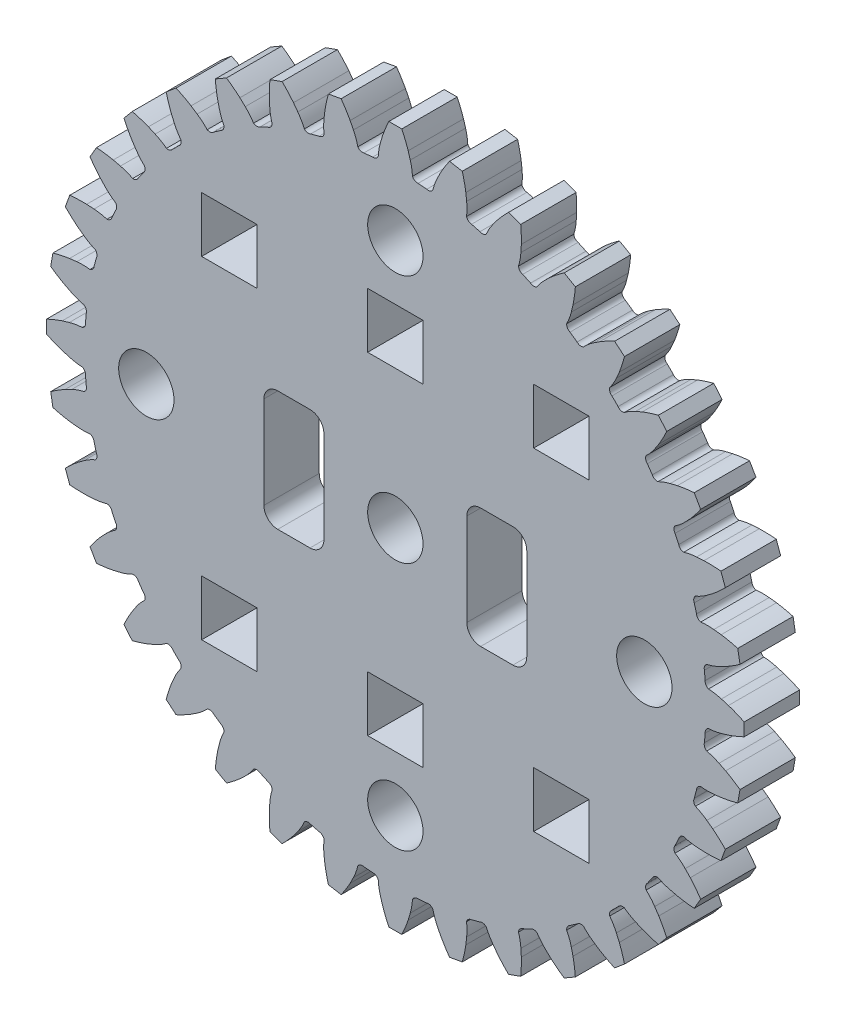
from build123d import *

# Parameters (mm, degrees)
MODEL_R                 = 1.5
MODEL_W                 = 3
MODEL_H                 = 3
SALIENTE_EXTRUIR1_DEPTH = 3


with BuildPart() as part:
    # Model → Saliente-Extruir1 (new body)
    with BuildSketch(Plane.XY):
        with BuildLine():
            Line((31.003175283, 290.835738864), (31.240405981, 291.156201018))
            ThreePointArc((31.240405981, 291.156201018), (31.538382446, 291.506827512), (31.857600686, 291.838231535))
            Line((31.857600686, 291.838231535), (32.515213457, 291.598880061))
            ThreePointArc((32.515213457, 291.598880061), (32.546726416, 291.139820321), (32.549611265, 290.679689264))
            Line((32.549611265, 290.679689264), (32.525351421, 290.281712059))
            ThreePointArc((32.525351421, 290.281712059), (32.481384061, 289.927376903), (32.396011436, 289.580681005))
            ThreePointArc((32.396011436, 289.580681005), (32.465041706, 289.408773691), (32.621932953, 289.310272727))
            Line((32.621932953, 289.310272727), (33.049303766, 289.110986444))
            ThreePointArc((33.049303766, 289.110986444), (33.225607631, 289.054115975), (33.401668077, 289.111735612))
            ThreePointArc((33.401668077, 289.111735612), (33.612376078, 289.399986665), (33.85555088, 289.661429864))
            Line((33.85555088, 289.661429864), (34.14482518, 289.935828799))
            ThreePointArc((34.14482518, 289.935828799), (34.499160364, 290.229385419), (34.871076667, 290.500323004))
            Line((34.871076667, 290.500323004), (35.477135875, 290.150414558))
            ThreePointArc((35.477135875, 290.150414558), (35.428455194, 289.692856799), (35.351395296, 289.239215218))
            Line((35.351395296, 289.239215218), (35.258395997, 288.851496858))
            ThreePointArc((35.258395997, 288.851496858), (35.153566946, 288.510179702), (35.009288212, 288.183575694))
            ThreePointArc((35.009288212, 288.183575694), (35.047418366, 288.002293058), (35.184821568, 287.878044666))
            Line((35.184821568, 287.878044666), (35.571093959, 287.607573826))
            ThreePointArc((35.571093959, 287.607573826), (35.734843919, 287.520952503), (35.918235156, 287.547124192))
            ThreePointArc((35.918235156, 287.547124192), (36.175796299, 287.794407003), (36.460675865, 288.009651431))
            Line((36.460675865, 288.009651431), (36.793204313, 288.229649676))
            ThreePointArc((36.793204313, 288.229649676), (37.193131921, 288.457216851), (37.606445798, 288.659455698))
            Line((37.606445798, 288.659455698), (38.14253664, 288.20962207))
            ThreePointArc((38.14253664, 288.20962207), (38.015141457, 287.767468953), (37.860478239, 287.334100518))
            Line((37.860478239, 287.334100518), (37.701565221, 286.96842163))
            ThreePointArc((37.701565221, 286.96842163), (37.539059657, 286.650493222), (37.340258651, 286.353904802))
            ThreePointArc((37.340258651, 286.353904802), (37.346330122, 286.168755024), (37.460070355, 286.022534429))
            Line((37.460070355, 286.022534429), (37.793507632, 285.689097152))
            ThreePointArc((37.793507632, 285.689097152), (37.939728227, 285.57535692), (38.124878005, 285.569285448))
            ThreePointArc((38.124878005, 285.569285448), (38.421466425, 285.768086455), (38.739394832, 285.930592019))
            Line((38.739394832, 285.930592019), (39.105073721, 286.089505036))
            ThreePointArc((39.105073721, 286.089505036), (39.538442155, 286.244168255), (39.980595272, 286.371563438))
            Line((39.980595272, 286.371563438), (40.430428901, 285.835472595))
            ThreePointArc((40.430428901, 285.835472595), (40.228190054, 285.422158719), (40.000622878, 285.02223111))
            Line((40.000622878, 285.02223111), (39.780624634, 284.689702662))
            ThreePointArc((39.780624634, 284.689702662), (39.565380206, 284.404823096), (39.318097395, 284.147261953))
            ThreePointArc((39.318097395, 284.147261953), (39.291925706, 283.963870717), (39.378547028, 283.800120757))
            Line((39.378547028, 283.800120757), (39.649017868, 283.413848366))
            ThreePointArc((39.649017868, 283.413848366), (39.77326626, 283.276445163), (39.954548897, 283.23831501))
            ThreePointArc((39.954548897, 283.23831501), (40.281152905, 283.382593743), (40.622470061, 283.487422794))
            Line((40.622470061, 283.487422794), (41.010188421, 283.580422093))
            ThreePointArc((41.010188421, 283.580422093), (41.463830001, 283.657481991), (41.92138776, 283.706162672))
            Line((41.92138776, 283.706162672), (42.271296207, 283.100103464))
            ThreePointArc((42.271296207, 283.100103464), (42.000358621, 282.728187161), (41.706802002, 282.373851977))
            Line((41.706802002, 282.373851977), (41.432403066, 282.084577678))
            ThreePointArc((41.432403066, 282.084577678), (41.170959867, 281.841402875), (40.882708815, 281.630694874))
            ThreePointArc((40.882708815, 281.630694874), (40.825089178, 281.454634429), (40.881959646, 281.278330564))
            Line((40.881959646, 281.278330564), (41.08124593, 280.85095975))
            ThreePointArc((41.08124593, 280.85095975), (41.179746893, 280.694068504), (41.351654208, 280.625038233))
            ThreePointArc((41.351654208, 280.625038233), (41.698350106, 280.710410858), (42.052685261, 280.754378218))
            Line((42.052685261, 280.754378218), (42.450662467, 280.778638062))
            ThreePointArc((42.450662467, 280.778638062), (42.910793523, 280.775753213), (43.369853263, 280.744240254))
            Line((43.369853263, 280.744240254), (43.609204738, 280.086627483))
            ThreePointArc((43.609204738, 280.086627483), (43.277800714, 279.767409243), (42.927174221, 279.469432778))
            Line((42.927174221, 279.469432778), (42.606712067, 279.232202081))
            ThreePointArc((42.606712067, 279.232202081), (42.307013916, 279.038120785), (41.986552984, 278.880668182))
            ThreePointArc((41.986552984, 278.880668182), (41.899236144, 278.717288035), (41.924627777, 278.533787169))
            Line((41.924627777, 278.533787169), (42.046674291, 278.078303378))
            ThreePointArc((42.046674291, 278.078303378), (42.116434925, 277.90669115), (42.2737436, 277.808858212))
            ThreePointArc((42.2737436, 277.808858212), (42.629997209, 277.832730724), (42.986584069, 277.814500467))
            Line((42.986584069, 277.814500467), (43.382727784, 277.769283733))
            ThreePointArc((43.382727784, 277.769283733), (43.835367467, 277.686541792), (44.281980891, 277.575792698))
            Line((44.281980891, 277.575792698), (44.403502819, 276.886607596))
            ThreePointArc((44.403502819, 276.886607596), (44.021701902, 276.629786702), (43.624659142, 276.397222822))
            Line((43.624659142, 276.397222822), (43.26787085, 276.21924386))
            ThreePointArc((43.26787085, 276.21924386), (42.939023924, 276.080153133), (42.596090156, 275.980740046))
            ThreePointArc((42.596090156, 275.980740046), (42.48172919, 275.835004421), (42.474870477, 275.649882134))
            Line((42.474870477, 275.649882134), (42.515968899, 275.180125011))
            ThreePointArc((42.515968899, 275.180125011), (42.554869562, 274.999006151), (42.692799853, 274.875343151))
            ThreePointArc((42.692799853, 274.875343151), (43.047786588, 274.836990196), (43.395790441, 274.757116239))
            Line((43.395790441, 274.757116239), (43.77806404, 274.643796814))
            ThreePointArc((43.77806404, 274.643796814), (44.209459122, 274.483711853), (44.630056106, 274.29709168))
            Line((44.630056106, 274.29709168), (44.630056106, 273.597274786))
            ThreePointArc((44.630056106, 273.597274786), (44.209459122, 273.410654613), (43.77806404, 273.250569652))
            Line((43.77806404, 273.250569652), (43.395790441, 273.137250227))
            ThreePointArc((43.395790441, 273.137250227), (43.047786588, 273.05737627), (42.692799853, 273.019023315))
            ThreePointArc((42.692799853, 273.019023315), (42.554869562, 272.895360315), (42.515968899, 272.714241455))
            Line((42.515968899, 272.714241455), (42.474870477, 272.244484332))
            ThreePointArc((42.474870477, 272.244484332), (42.48172919, 272.059362045), (42.596090156, 271.91362642))
            ThreePointArc((42.596090156, 271.91362642), (42.939023924, 271.814213333), (43.26787085, 271.675122606))
            Line((43.26787085, 271.675122606), (43.624659142, 271.497143644))
            ThreePointArc((43.624659142, 271.497143644), (44.021701902, 271.264579763), (44.403502819, 271.00775887))
            Line((44.403502819, 271.00775887), (44.281980891, 270.318573768))
            ThreePointArc((44.281980891, 270.318573768), (43.835367467, 270.207824674), (43.382727784, 270.125082733))
            Line((43.382727784, 270.125082733), (42.986584069, 270.079865999))
            ThreePointArc((42.986584069, 270.079865999), (42.629997209, 270.061635742), (42.2737436, 270.085508254))
            ThreePointArc((42.2737436, 270.085508254), (42.116434925, 269.987675316), (42.046674291, 269.816063088))
            Line((42.046674291, 269.816063088), (41.924627777, 269.360579297))
            ThreePointArc((41.924627777, 269.360579297), (41.899236144, 269.177078431), (41.986552984, 269.013698284))
            ThreePointArc((41.986552984, 269.013698284), (42.307013916, 268.856245681), (42.606712067, 268.662164385))
            Line((42.606712067, 268.662164385), (42.927174221, 268.424933687))
            ThreePointArc((42.927174221, 268.424933687), (43.277800714, 268.126957223), (43.609204738, 267.807738983))
            Line((43.609204738, 267.807738983), (43.369853263, 267.150126212))
            ThreePointArc((43.369853263, 267.150126212), (42.910793523, 267.118613253), (42.450662467, 267.115728404))
            Line((42.450662467, 267.115728404), (42.052685261, 267.139988248))
            ThreePointArc((42.052685261, 267.139988248), (41.698350106, 267.183955608), (41.351654208, 267.269328233))
            ThreePointArc((41.351654208, 267.269328233), (41.179746893, 267.200297962), (41.08124593, 267.043406716))
            Line((41.08124593, 267.043406716), (40.881959646, 266.616035902))
            ThreePointArc((40.881959646, 266.616035902), (40.825089178, 266.439732037), (40.882708815, 266.263671592))
            ThreePointArc((40.882708815, 266.263671592), (41.170959867, 266.052963591), (41.432403066, 265.809788788))
            Line((41.432403066, 265.809788788), (41.706802002, 265.520514489))
            ThreePointArc((41.706802002, 265.520514489), (42.000358621, 265.166179304), (42.271296207, 264.794263002))
            Line((42.271296207, 264.794263002), (41.92138776, 264.188203794))
            ThreePointArc((41.92138776, 264.188203794), (41.463830001, 264.236884475), (41.010188421, 264.313944373))
            Line((41.010188421, 264.313944373), (40.622470061, 264.406943672))
            ThreePointArc((40.622470061, 264.406943672), (40.281152905, 264.511772723), (39.954548897, 264.656051456))
            ThreePointArc((39.954548897, 264.656051456), (39.77326626, 264.617921303), (39.649017868, 264.4805181))
            Line((39.649017868, 264.4805181), (39.378547028, 264.094245709))
            ThreePointArc((39.378547028, 264.094245709), (39.291925705, 263.930495749), (39.318097395, 263.747104512))
            ThreePointArc((39.318097395, 263.747104512), (39.565380206, 263.48954337), (39.780624634, 263.204663804))
            Line((39.780624634, 263.204663804), (40.000622878, 262.872135356))
            ThreePointArc((40.000622878, 262.872135356), (40.228190054, 262.472207747), (40.430428901, 262.058893871))
            Line((40.430428901, 262.058893871), (39.980595272, 261.522803028))
            ThreePointArc((39.980595272, 261.522803028), (39.538442155, 261.650198211), (39.105073721, 261.80486143))
            Line((39.105073721, 261.80486143), (38.739394832, 261.963774447))
            ThreePointArc((38.739394832, 261.963774447), (38.421466425, 262.126280011), (38.124878005, 262.325081018))
            ThreePointArc((38.124878005, 262.325081018), (37.939728227, 262.319009546), (37.793507632, 262.205269314))
            Line((37.793507632, 262.205269314), (37.460070355, 261.871832037))
            ThreePointArc((37.460070355, 261.871832037), (37.346330122, 261.725611441), (37.340258651, 261.540461664))
            ThreePointArc((37.340258651, 261.540461664), (37.539059657, 261.243873244), (37.701565221, 260.925944836))
            Line((37.701565221, 260.925944836), (37.860478239, 260.560265948))
            ThreePointArc((37.860478239, 260.560265948), (38.015141457, 260.126897513), (38.14253664, 259.684744396))
            Line((38.14253664, 259.684744396), (37.606445798, 259.234910768))
            ThreePointArc((37.606445798, 259.234910768), (37.193131921, 259.437149615), (36.793204313, 259.66471679))
            Line((36.793204313, 259.66471679), (36.460675865, 259.884715035))
            ThreePointArc((36.460675865, 259.884715035), (36.175796299, 260.099959463), (35.918235156, 260.347242274))
            ThreePointArc((35.918235156, 260.347242274), (35.734843919, 260.373413963), (35.571093959, 260.28679264))
            Line((35.571093959, 260.28679264), (35.184821568, 260.0163218))
            ThreePointArc((35.184821568, 260.0163218), (35.047418366, 259.892073408), (35.009288212, 259.710790772))
            ThreePointArc((35.009288212, 259.710790772), (35.153566946, 259.384186764), (35.258395997, 259.042869608))
            Line((35.258395997, 259.042869608), (35.351395296, 258.655151248))
            ThreePointArc((35.351395296, 258.655151248), (35.428455194, 258.201509667), (35.477135875, 257.743951908))
            Line((35.477135875, 257.743951908), (34.871076667, 257.394043461))
            ThreePointArc((34.871076667, 257.394043461), (34.499160364, 257.664981047), (34.14482518, 257.958537667))
            Line((34.14482518, 257.958537667), (33.85555088, 258.232936602))
            ThreePointArc((33.85555088, 258.232936602), (33.612376078, 258.494379801), (33.401668077, 258.782630854))
            ThreePointArc((33.401668077, 258.782630854), (33.225607631, 258.84025049), (33.049303766, 258.783380022))
            Line((33.049303766, 258.783380022), (32.621932953, 258.584093739))
            ThreePointArc((32.621932953, 258.584093739), (32.465041706, 258.485592775), (32.396011436, 258.313685461))
            ThreePointArc((32.396011436, 258.313685461), (32.481384061, 257.966989562), (32.525351421, 257.612654407))
            Line((32.525351421, 257.612654407), (32.549611265, 257.214677202))
            ThreePointArc((32.549611265, 257.214677202), (32.546726416, 256.754546145), (32.515213457, 256.295486405))
            Line((32.515213457, 256.295486405), (31.857600686, 256.056134931))
            ThreePointArc((31.857600686, 256.056134931), (31.538382446, 256.387538954), (31.240405981, 256.738165448))
            Line((31.240405981, 256.738165448), (31.003175283, 257.058627602))
            ThreePointArc((31.003175283, 257.058627602), (30.809093987, 257.358325753), (30.651641384, 257.678786684))
            ThreePointArc((30.651641384, 257.678786684), (30.488261238, 257.766103525), (30.304760371, 257.740711892))
            Line((30.304760371, 257.740711892), (29.849276581, 257.618665378))
            ThreePointArc((29.849276581, 257.618665378), (29.677664352, 257.548904744), (29.579831415, 257.391596069))
            ThreePointArc((29.579831415, 257.391596069), (29.603703927, 257.035342459), (29.58547367, 256.678755599))
            Line((29.58547367, 256.678755599), (29.540256936, 256.282611884))
            ThreePointArc((29.540256936, 256.282611884), (29.457514994, 255.829972201), (29.346765901, 255.383358778))
            Line((29.346765901, 255.383358778), (28.657580798, 255.26183685))
            ThreePointArc((28.657580798, 255.26183685), (28.400759905, 255.643637767), (28.168196024, 256.040680526))
            Line((28.168196024, 256.040680526), (27.990217063, 256.397468818))
            ThreePointArc((27.990217063, 256.397468818), (27.851126336, 256.726315744), (27.751713248, 257.069249512))
            ThreePointArc((27.751713248, 257.069249512), (27.605977623, 257.183610478), (27.420855337, 257.190469192))
            Line((27.420855337, 257.190469192), (26.951098213, 257.149370769))
            ThreePointArc((26.951098213, 257.149370769), (26.769979353, 257.110470107), (26.646316353, 256.972539815))
            ThreePointArc((26.646316353, 256.972539815), (26.607963398, 256.61755308), (26.528089441, 256.269549227))
            Line((26.528089441, 256.269549227), (26.414770017, 255.887275628))
            ThreePointArc((26.414770017, 255.887275628), (26.254685056, 255.455880546), (26.068064882, 255.035283563))
            Line((26.068064882, 255.035283563), (25.368247989, 255.035283563))
            ThreePointArc((25.368247989, 255.035283563), (25.181627815, 255.455880546), (25.021542854, 255.887275628))
            Line((25.021542854, 255.887275628), (24.90822343, 256.269549227))
            ThreePointArc((24.90822343, 256.269549227), (24.828349473, 256.61755308), (24.789996518, 256.972539815))
            ThreePointArc((24.789996518, 256.972539815), (24.666333518, 257.110470107), (24.485214658, 257.149370769))
            Line((24.485214658, 257.149370769), (24.015457534, 257.190469192))
            ThreePointArc((24.015457534, 257.190469192), (23.830335248, 257.183610478), (23.684599623, 257.069249512))
            ThreePointArc((23.684599623, 257.069249512), (23.585186535, 256.726315744), (23.446095808, 256.397468818))
            Line((23.446095808, 256.397468818), (23.268116847, 256.040680526))
            ThreePointArc((23.268116847, 256.040680526), (23.035552966, 255.643637767), (22.778732073, 255.26183685))
            Line((22.778732073, 255.26183685), (22.08954697, 255.383358778))
            ThreePointArc((22.08954697, 255.383358778), (21.978797877, 255.829972201), (21.896055935, 256.282611884))
            Line((21.896055935, 256.282611884), (21.850839202, 256.678755599))
            ThreePointArc((21.850839202, 256.678755599), (21.832608944, 257.035342459), (21.856481456, 257.391596069))
            ThreePointArc((21.856481456, 257.391596069), (21.758648519, 257.548904744), (21.58703629, 257.618665378))
            Line((21.58703629, 257.618665378), (21.1315525, 257.740711892))
            ThreePointArc((21.1315525, 257.740711892), (20.948051633, 257.766103525), (20.784671487, 257.678786684))
            ThreePointArc((20.784671487, 257.678786684), (20.627218884, 257.358325753), (20.433137588, 257.058627602))
            Line((20.433137588, 257.058627602), (20.19590689, 256.738165448))
            ThreePointArc((20.19590689, 256.738165448), (19.897930425, 256.387538954), (19.578712185, 256.056134931))
            Line((19.578712185, 256.056134931), (18.921099414, 256.295486405))
            ThreePointArc((18.921099414, 256.295486405), (18.889586455, 256.754546145), (18.886701606, 257.214677202))
            Line((18.886701606, 257.214677202), (18.91096145, 257.612654407))
            ThreePointArc((18.91096145, 257.612654407), (18.95492881, 257.966989562), (19.040301435, 258.313685461))
            ThreePointArc((19.040301435, 258.313685461), (18.971271165, 258.485592775), (18.814379918, 258.584093739))
            Line((18.814379918, 258.584093739), (18.387009105, 258.783380022))
            ThreePointArc((18.387009105, 258.783380022), (18.21070524, 258.84025049), (18.034644794, 258.782630854))
            ThreePointArc((18.034644794, 258.782630854), (17.823936793, 258.494379801), (17.580761991, 258.232936602))
            Line((17.580761991, 258.232936602), (17.291487691, 257.958537667))
            ThreePointArc((17.291487691, 257.958537667), (16.937152507, 257.664981047), (16.565236204, 257.394043461))
            Line((16.565236204, 257.394043461), (15.959176996, 257.743951908))
            ThreePointArc((15.959176996, 257.743951908), (16.007857677, 258.201509667), (16.084917575, 258.655151248))
            Line((16.084917575, 258.655151248), (16.177916874, 259.042869608))
            ThreePointArc((16.177916874, 259.042869608), (16.282745925, 259.384186764), (16.427024659, 259.710790772))
            ThreePointArc((16.427024659, 259.710790772), (16.388894505, 259.892073408), (16.251491302, 260.0163218))
            Line((16.251491302, 260.0163218), (15.865218912, 260.28679264))
            ThreePointArc((15.865218912, 260.28679264), (15.701468952, 260.373413963), (15.518077715, 260.347242274))
            ThreePointArc((15.518077715, 260.347242274), (15.260516572, 260.099959463), (14.975637006, 259.884715035))
            Line((14.975637006, 259.884715035), (14.643108558, 259.66471679))
            ThreePointArc((14.643108558, 259.66471679), (14.24318095, 259.437149615), (13.829867073, 259.234910768))
            Line((13.829867073, 259.234910768), (13.293776231, 259.684744396))
            ThreePointArc((13.293776231, 259.684744396), (13.421171414, 260.126897513), (13.575834632, 260.560265948))
            Line((13.575834632, 260.560265948), (13.73474765, 260.925944836))
            ThreePointArc((13.73474765, 260.925944836), (13.897253214, 261.243873244), (14.09605422, 261.540461664))
            ThreePointArc((14.09605422, 261.540461664), (14.089982749, 261.725611441), (13.976242516, 261.871832037))
            Line((13.976242516, 261.871832037), (13.642805239, 262.205269314))
            ThreePointArc((13.642805239, 262.205269314), (13.496584644, 262.319009546), (13.311434866, 262.325081018))
            ThreePointArc((13.311434866, 262.325081018), (13.014846446, 262.126280011), (12.696918038, 261.963774447))
            Line((12.696918038, 261.963774447), (12.331239151, 261.80486143))
            ThreePointArc((12.331239151, 261.80486143), (11.897870716, 261.650198211), (11.455717598, 261.522803028))
            Line((11.455717598, 261.522803028), (11.00588397, 262.058893871))
            ThreePointArc((11.00588397, 262.058893871), (11.208122817, 262.472207747), (11.435689993, 262.872135356))
            Line((11.435689993, 262.872135356), (11.655688237, 263.204663804))
            ThreePointArc((11.655688237, 263.204663804), (11.870932665, 263.48954337), (12.118215476, 263.747104512))
            ThreePointArc((12.118215476, 263.747104512), (12.144387166, 263.930495749), (12.057765843, 264.094245709))
            Line((12.057765843, 264.094245709), (11.787295003, 264.4805181))
            ThreePointArc((11.787295003, 264.4805181), (11.663046611, 264.617921303), (11.481763974, 264.656051456))
            ThreePointArc((11.481763974, 264.656051456), (11.155159966, 264.511772723), (10.81384281, 264.406943672))
            Line((10.81384281, 264.406943672), (10.42612445, 264.313944373))
            ThreePointArc((10.42612445, 264.313944373), (9.97248287, 264.236884475), (9.514925111, 264.188203794))
            Line((9.514925111, 264.188203794), (9.165016664, 264.794263002))
            ThreePointArc((9.165016664, 264.794263002), (9.43595425, 265.166179304), (9.729510869, 265.520514489))
            Line((9.729510869, 265.520514489), (10.003909805, 265.809788788))
            ThreePointArc((10.003909805, 265.809788788), (10.265353004, 266.052963591), (10.553604056, 266.263671592))
            ThreePointArc((10.553604056, 266.263671592), (10.611223693, 266.439732037), (10.554353225, 266.616035902))
            Line((10.554353225, 266.616035902), (10.355066941, 267.043406716))
            ThreePointArc((10.355066941, 267.043406716), (10.256565978, 267.200297962), (10.084658663, 267.269328232))
            ThreePointArc((10.084658663, 267.269328232), (9.737962765, 267.183955608), (9.38362761, 267.139988248))
            Line((9.38362761, 267.139988248), (8.985650404, 267.115728404))
            ThreePointArc((8.985650404, 267.115728404), (8.525519348, 267.118613253), (8.066459608, 267.150126212))
            Line((8.066459608, 267.150126212), (7.827108133, 267.807738983))
            ThreePointArc((7.827108133, 267.807738983), (8.158512157, 268.126957223), (8.50913865, 268.424933687))
            Line((8.50913865, 268.424933687), (8.829600805, 268.662164385))
            ThreePointArc((8.829600805, 268.662164385), (9.129298955, 268.856245681), (9.449759887, 269.013698284))
            ThreePointArc((9.449759887, 269.013698284), (9.537076727, 269.177078431), (9.511685094, 269.360579297))
            Line((9.511685094, 269.360579297), (9.38963858, 269.816063088))
            ThreePointArc((9.38963858, 269.816063088), (9.319877946, 269.987675316), (9.162569271, 270.085508254))
            ThreePointArc((9.162569271, 270.085508254), (8.806315662, 270.061635742), (8.449728802, 270.079865999))
            Line((8.449728802, 270.079865999), (8.053585087, 270.125082733))
            ThreePointArc((8.053585087, 270.125082733), (7.600945404, 270.207824674), (7.15433198, 270.318573768))
            Line((7.15433198, 270.318573768), (7.032810052, 271.00775887))
            ThreePointArc((7.032810052, 271.00775887), (7.414610969, 271.264579763), (7.811653729, 271.497143644))
            Line((7.811653729, 271.497143644), (8.168442021, 271.675122606))
            ThreePointArc((8.168442021, 271.675122606), (8.497288947, 271.814213333), (8.840222715, 271.91362642))
            ThreePointArc((8.840222715, 271.91362642), (8.954583681, 272.059362045), (8.961442395, 272.244484332))
            Line((8.961442395, 272.244484332), (8.920343972, 272.714241455))
            ThreePointArc((8.920343972, 272.714241455), (8.881443309, 272.895360315), (8.743513018, 273.019023315))
            ThreePointArc((8.743513018, 273.019023315), (8.388526283, 273.05737627), (8.040522429, 273.137250227))
            Line((8.040522429, 273.137250227), (7.658248831, 273.250569652))
            ThreePointArc((7.658248831, 273.250569652), (7.226853749, 273.410654613), (6.806256765, 273.597274786))
            Line((6.806256765, 273.597274786), (6.806256765, 274.29709168))
            ThreePointArc((6.806256765, 274.29709168), (7.226853749, 274.483711853), (7.658248831, 274.643796814))
            Line((7.658248831, 274.643796814), (8.040522429, 274.757116239))
            ThreePointArc((8.040522429, 274.757116239), (8.388526283, 274.836990196), (8.743513018, 274.875343151))
            ThreePointArc((8.743513018, 274.875343151), (8.881443309, 274.999006151), (8.920343972, 275.180125011))
            Line((8.920343972, 275.180125011), (8.961442395, 275.649882134))
            ThreePointArc((8.961442395, 275.649882134), (8.954583681, 275.835004421), (8.840222715, 275.980740046))
            ThreePointArc((8.840222715, 275.980740046), (8.497288947, 276.080153133), (8.168442021, 276.21924386))
            Line((8.168442021, 276.21924386), (7.811653729, 276.397222822))
            ThreePointArc((7.811653729, 276.397222822), (7.414610969, 276.629786702), (7.032810052, 276.886607596))
            Line((7.032810052, 276.886607596), (7.15433198, 277.575792698))
            ThreePointArc((7.15433198, 277.575792698), (7.600945404, 277.686541792), (8.053585087, 277.769283733))
            Line((8.053585087, 277.769283733), (8.449728802, 277.814500467))
            ThreePointArc((8.449728802, 277.814500467), (8.806315662, 277.832730724), (9.162569271, 277.808858212))
            ThreePointArc((9.162569271, 277.808858212), (9.319877946, 277.90669115), (9.38963858, 278.078303378))
            Line((9.38963858, 278.078303378), (9.511685094, 278.533787169))
            ThreePointArc((9.511685094, 278.533787169), (9.537076727, 278.717288035), (9.449759887, 278.880668182))
            ThreePointArc((9.449759887, 278.880668182), (9.129298955, 279.038120785), (8.829600805, 279.232202081))
            Line((8.829600805, 279.232202081), (8.50913865, 279.469432778))
            ThreePointArc((8.50913865, 279.469432778), (8.158512157, 279.767409243), (7.827108133, 280.086627483))
            Line((7.827108133, 280.086627483), (8.066459608, 280.744240254))
            ThreePointArc((8.066459608, 280.744240254), (8.525519348, 280.775753213), (8.985650404, 280.778638062))
            Line((8.985650404, 280.778638062), (9.38362761, 280.754378218))
            ThreePointArc((9.38362761, 280.754378218), (9.737962765, 280.710410858), (10.084658663, 280.625038233))
            ThreePointArc((10.084658663, 280.625038233), (10.256565978, 280.694068504), (10.355066941, 280.85095975))
            Line((10.355066941, 280.85095975), (10.554353225, 281.278330564))
            ThreePointArc((10.554353225, 281.278330564), (10.611223693, 281.454634429), (10.553604056, 281.630694874))
            ThreePointArc((10.553604056, 281.630694874), (10.265353004, 281.841402875), (10.003909805, 282.084577678))
            Line((10.003909805, 282.084577678), (9.729510869, 282.373851977))
            ThreePointArc((9.729510869, 282.373851977), (9.43595425, 282.728187161), (9.165016664, 283.100103464))
            Line((9.165016664, 283.100103464), (9.514925111, 283.706162672))
            ThreePointArc((9.514925111, 283.706162672), (9.97248287, 283.657481991), (10.42612445, 283.580422093))
            Line((10.42612445, 283.580422093), (10.81384281, 283.487422794))
            ThreePointArc((10.81384281, 283.487422794), (11.155159966, 283.382593743), (11.481763974, 283.23831501))
            ThreePointArc((11.481763974, 283.23831501), (11.663046611, 283.276445163), (11.787295003, 283.413848366))
            Line((11.787295003, 283.413848366), (12.057765843, 283.800120757))
            ThreePointArc((12.057765843, 283.800120757), (12.144387166, 283.963870717), (12.118215476, 284.147261954))
            ThreePointArc((12.118215476, 284.147261954), (11.870932665, 284.404823096), (11.655688237, 284.689702662))
            Line((11.655688237, 284.689702662), (11.435689993, 285.02223111))
            ThreePointArc((11.435689993, 285.02223111), (11.208122817, 285.422158719), (11.00588397, 285.835472595))
            Line((11.00588397, 285.835472595), (11.455717598, 286.371563438))
            ThreePointArc((11.455717598, 286.371563438), (11.897870716, 286.244168255), (12.331239151, 286.089505036))
            Line((12.331239151, 286.089505036), (12.696918038, 285.930592019))
            ThreePointArc((12.696918038, 285.930592019), (13.014846446, 285.768086455), (13.311434866, 285.569285448))
            ThreePointArc((13.311434866, 285.569285448), (13.496584644, 285.57535692), (13.642805239, 285.689097152))
            Line((13.642805239, 285.689097152), (13.976242516, 286.022534429))
            ThreePointArc((13.976242516, 286.022534429), (14.089982749, 286.168755024), (14.09605422, 286.353904802))
            ThreePointArc((14.09605422, 286.353904802), (13.897253214, 286.650493222), (13.73474765, 286.96842163))
            Line((13.73474765, 286.96842163), (13.575834632, 287.334100518))
            ThreePointArc((13.575834632, 287.334100518), (13.421171414, 287.767468953), (13.293776231, 288.20962207))
            Line((13.293776231, 288.20962207), (13.829867073, 288.659455698))
            ThreePointArc((13.829867073, 288.659455698), (14.24318095, 288.457216851), (14.643108558, 288.229649676))
            Line((14.643108558, 288.229649676), (14.975637006, 288.009651431))
            ThreePointArc((14.975637006, 288.009651431), (15.260516572, 287.794407003), (15.518077715, 287.547124192))
            ThreePointArc((15.518077715, 287.547124192), (15.701468952, 287.520952503), (15.865218912, 287.607573826))
            Line((15.865218912, 287.607573826), (16.251491302, 287.878044666))
            ThreePointArc((16.251491302, 287.878044666), (16.388894505, 288.002293058), (16.427024659, 288.183575694))
            ThreePointArc((16.427024659, 288.183575694), (16.282745925, 288.510179702), (16.177916874, 288.851496858))
            Line((16.177916874, 288.851496858), (16.084917575, 289.239215218))
            ThreePointArc((16.084917575, 289.239215218), (16.007857677, 289.692856799), (15.959176996, 290.150414558))
            Line((15.959176996, 290.150414558), (16.565236204, 290.500323004))
            ThreePointArc((16.565236204, 290.500323004), (16.937152507, 290.229385419), (17.291487691, 289.935828799))
            Line((17.291487691, 289.935828799), (17.580761991, 289.661429864))
            ThreePointArc((17.580761991, 289.661429864), (17.823936793, 289.399986665), (18.034644794, 289.111735612))
            ThreePointArc((18.034644794, 289.111735612), (18.21070524, 289.054115975), (18.387009105, 289.110986444))
            Line((18.387009105, 289.110986444), (18.814379918, 289.310272727))
            ThreePointArc((18.814379918, 289.310272727), (18.971271165, 289.408773691), (19.040301435, 289.580681005))
            ThreePointArc((19.040301435, 289.580681005), (18.95492881, 289.927376903), (18.91096145, 290.281712059))
            Line((18.91096145, 290.281712059), (18.886701606, 290.679689264))
            ThreePointArc((18.886701606, 290.679689264), (18.889586455, 291.139820321), (18.921099414, 291.598880061))
            Line((18.921099414, 291.598880061), (19.578712185, 291.838231535))
            ThreePointArc((19.578712185, 291.838231535), (19.897930425, 291.506827512), (20.19590689, 291.156201018))
            Line((20.19590689, 291.156201018), (20.433137588, 290.835738864))
            ThreePointArc((20.433137588, 290.835738864), (20.627218884, 290.536040713), (20.784671487, 290.215579781))
            ThreePointArc((20.784671487, 290.215579781), (20.948051633, 290.128262941), (21.1315525, 290.153654574))
            Line((21.1315525, 290.153654574), (21.58703629, 290.275701088))
            ThreePointArc((21.58703629, 290.275701088), (21.758648519, 290.345461722), (21.856481456, 290.502770397))
            ThreePointArc((21.856481456, 290.502770397), (21.832608944, 290.859024007), (21.850839202, 291.215610867))
            Line((21.850839202, 291.215610867), (21.896055935, 291.611754582))
            ThreePointArc((21.896055935, 291.611754582), (21.978797877, 292.064394265), (22.08954697, 292.511007688))
            Line((22.08954697, 292.511007688), (22.778732073, 292.632529616))
            ThreePointArc((22.778732073, 292.632529616), (23.035552966, 292.250728699), (23.268116847, 291.85368594))
            Line((23.268116847, 291.85368594), (23.446095808, 291.496897647))
            ThreePointArc((23.446095808, 291.496897647), (23.585186535, 291.168050722), (23.684599623, 290.825116954))
            ThreePointArc((23.684599623, 290.825116954), (23.830335248, 290.710755988), (24.015457534, 290.703897274))
            Line((24.015457534, 290.703897274), (24.485214658, 290.744995697))
            ThreePointArc((24.485214658, 290.744995697), (24.666333518, 290.783896359), (24.789996518, 290.921826651))
            ThreePointArc((24.789996518, 290.921826651), (24.828349473, 291.276813386), (24.90822343, 291.624817239))
            Line((24.90822343, 291.624817239), (25.021542854, 292.007090838))
            ThreePointArc((25.021542854, 292.007090838), (25.181627815, 292.43848592), (25.368247989, 292.859082903))
            Line((25.368247989, 292.859082903), (26.068064882, 292.859082903))
            ThreePointArc((26.068064882, 292.859082903), (26.254685056, 292.43848592), (26.414770017, 292.007090838))
            Line((26.414770017, 292.007090838), (26.528089441, 291.624817239))
            ThreePointArc((26.528089441, 291.624817239), (26.607963398, 291.276813386), (26.646316353, 290.921826651))
            ThreePointArc((26.646316353, 290.921826651), (26.769979353, 290.783896359), (26.951098213, 290.744995697))
            Line((26.951098213, 290.744995697), (27.420855337, 290.703897274))
            ThreePointArc((27.420855337, 290.703897274), (27.605977623, 290.710755988), (27.751713248, 290.825116954))
            ThreePointArc((27.751713248, 290.825116954), (27.851126336, 291.168050722), (27.990217063, 291.496897647))
            Line((27.990217063, 291.496897647), (28.168196024, 291.85368594))
            ThreePointArc((28.168196024, 291.85368594), (28.400759905, 292.250728699), (28.657580798, 292.632529616))
            Line((28.657580798, 292.632529616), (29.346765901, 292.511007688))
            ThreePointArc((29.346765901, 292.511007688), (29.457514994, 292.064394265), (29.540256936, 291.611754582))
            Line((29.540256936, 291.611754582), (29.58547367, 291.215610867))
            ThreePointArc((29.58547367, 291.215610867), (29.603703927, 290.859024007), (29.579831415, 290.502770397))
            ThreePointArc((29.579831415, 290.502770397), (29.677664352, 290.345461722), (29.849276581, 290.275701088))
            Line((29.849276581, 290.275701088), (30.304760371, 290.153654574))
            ThreePointArc((30.304760371, 290.153654574), (30.488261238, 290.128262941), (30.651641384, 290.215579781))
            ThreePointArc((30.651641384, 290.215579781), (30.809093987, 290.536040713), (31.003175283, 290.835738864))
        make_face()
        with Locations((39.218156435, 273.947183233)):
            Circle(MODEL_R, mode=Mode.SUBTRACT)
        with Locations((25.718156435, 273.947183233)):
            Circle(MODEL_R, mode=Mode.SUBTRACT)
        with Locations((12.218156435, 273.947183233)):
            Circle(MODEL_R, mode=Mode.SUBTRACT)
        with Locations((25.718156435, 260.447183233)):
            Circle(MODEL_R, mode=Mode.SUBTRACT)
        with Locations((25.718156435, 287.447183233)):
            Circle(MODEL_R, mode=Mode.SUBTRACT)
        with Locations((34.718156436, 282.947183233)):
            Rectangle(MODEL_W, MODEL_H, mode=Mode.SUBTRACT)
        with Locations((16.718156435, 282.947183233)):
            Rectangle(MODEL_W, MODEL_H, mode=Mode.SUBTRACT)
        with Locations((25.718156435, 282.947183233)):
            Rectangle(MODEL_W, MODEL_H, mode=Mode.SUBTRACT)
        with Locations((34.718156436, 264.947183233)):
            Rectangle(MODEL_W, MODEL_H, mode=Mode.SUBTRACT)
        with Locations((16.718156435, 264.947183233)):
            Rectangle(MODEL_W, MODEL_H, mode=Mode.SUBTRACT)
        with Locations((25.718156435, 264.947183233)):
            Rectangle(MODEL_W, MODEL_H, mode=Mode.SUBTRACT)
        with BuildLine():
            Line((32.093156435, 277.197183233), (30.343156435, 277.197183233))
            ThreePointArc((30.343156435, 277.197183233), (29.81282635, 276.977513319), (29.593156435, 276.447183233))
            Line((29.593156435, 276.447183233), (29.593156435, 271.447183233))
            ThreePointArc((29.593156435, 271.447183233), (29.81282635, 270.916853147), (30.343156435, 270.697183233))
            Line((30.343156435, 270.697183233), (32.093156435, 270.697183233))
            ThreePointArc((32.093156435, 270.697183233), (32.623486521, 270.916853147), (32.843156435, 271.447183233))
            Line((32.843156435, 271.447183233), (32.843156435, 276.447183233))
            ThreePointArc((32.843156435, 276.447183233), (32.623486521, 276.977513319), (32.093156435, 277.197183233))
        make_face(mode=Mode.SUBTRACT)
        with BuildLine():
            Line((19.343156435, 277.197183233), (21.093156435, 277.197183233))
            ThreePointArc((21.093156435, 277.197183233), (21.623486521, 276.977513319), (21.843156435, 276.447183233))
            Line((21.843156435, 276.447183233), (21.843156435, 271.447183233))
            ThreePointArc((21.843156435, 271.447183233), (21.623486521, 270.916853147), (21.093156435, 270.697183233))
            Line((21.093156435, 270.697183233), (19.343156435, 270.697183233))
            ThreePointArc((19.343156435, 270.697183233), (18.81282635, 270.916853147), (18.593156435, 271.447183233))
            Line((18.593156435, 271.447183233), (18.593156435, 276.447183233))
            ThreePointArc((18.593156435, 276.447183233), (18.81282635, 276.977513319), (19.343156435, 277.197183233))
        make_face(mode=Mode.SUBTRACT)
    extrude(amount=SALIENTE_EXTRUIR1_DEPTH)


solid = part.part
